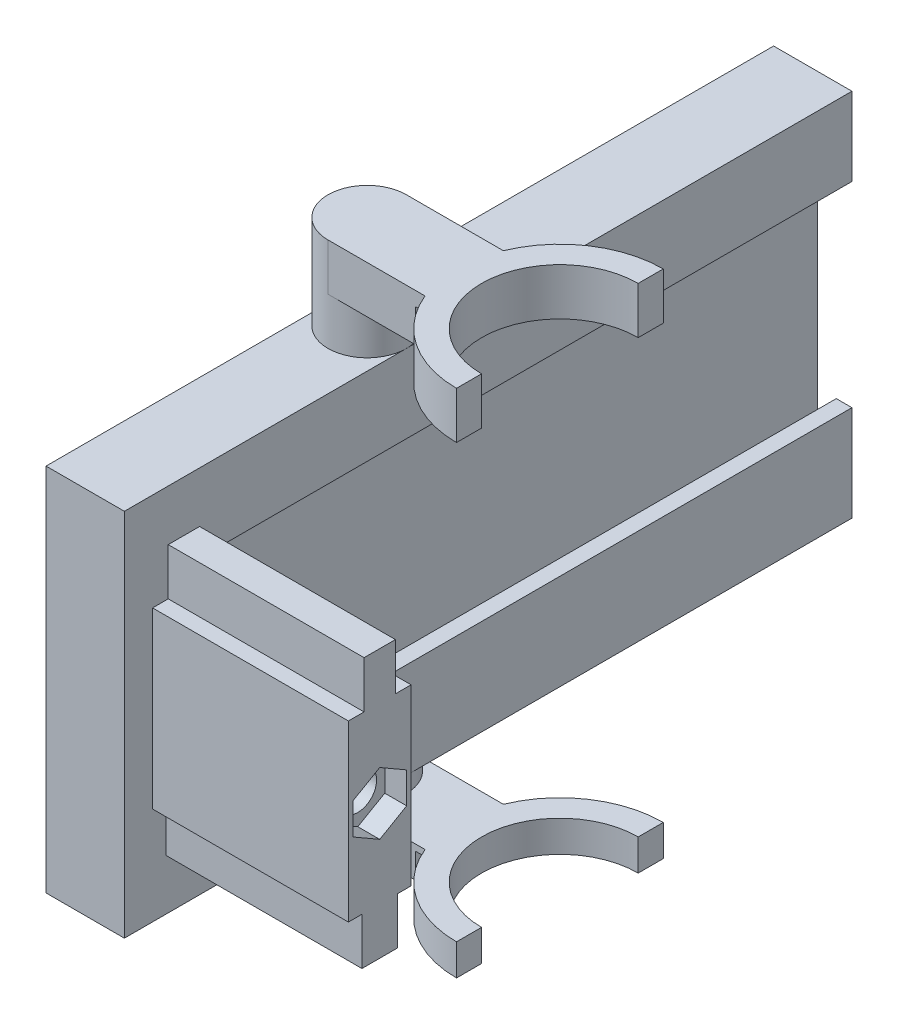
from build123d import *

# Parameters (mm, degrees)
BOSS_EXTRUDE1_DEPTH      = 320
SKETCH2_W                = 25
SKETCH2_H                = 100
BOSS_EXTRUDE2_DEPTH      = 50
CUT_EXTRUDE1_DEPTH       = 337.19190948
CUT_EXTRUDE1_DEPTH_BACK  = 337.19190948
SKETCH3_R                = 5
SKETCH4_W                = 150
SKETCH4_H                = 19.211352241
BOSS_EXTRUDE3_DEPTH      = 100
BOSS_EXTRUDE4_DEPTH      = 100
SKETCH6_W                = 42.1
SKETCH6_H                = 42.1
CUT_EXTRUDE2_DEPTH       = 10
SKETCH7_R                = 11
CUT_EXTRUDE3_DEPTH       = 2
CUT_EXTRUDE4_DEPTH       = 391.24267
CUT_EXTRUDE4_DEPTH_BACK  = 391.24267
SKETCH8_R                = 11
SKETCH10_R               = 25
SKETCH10_R_2             = 11
BOSS_EXTRUDE5_DEPTH      = 18
CUT_EXTRUDE6_DEPTH       = 381.347658714
CUT_EXTRUDE6_DEPTH_BACK  = 381.347658714
BOSS_EXTRUDE6_REACH      = 243.332
SKETCH12_W               = 150
SKETCH12_H               = 15
SKETCH13_W               = 165
SKETCH13_H               = 5
BOSS_EXTRUDE7_DEPTH      = 100
CUT_EXTRUDE7_DEPTH       = 282.821411126
CUT_EXTRUDE7_DEPTH_BACK  = 282.821411126
SKETCH16_W               = 62.5
SKETCH16_H               = 22.206056974
CUT_EXTRUDE9_DEPTH       = 298.574684732
SKETCH17_W               = 62.5
SKETCH17_H               = 5
BOSS_EXTRUDE8_DEPTH      = 15
SKETCH18_W               = 62.5
SKETCH18_H               = 11.362446971
BOSS_EXTRUDE9_DEPTH      = 15
SKETCH19_W               = 25
SKETCH19_H               = 100
BOSS_EXTRUDE11_DEPTH     = 9
SKETCH20_R               = 5
CUT_EXTRUDE10_DEPTH      = 62.5
SKETCH21_R               = 6
CUT_EXTRUDE11_DEPTH      = 62.5
CUT_EXTRUDE12_DEPTH      = 7
CUT_EXTRUDE13_DEPTH      = 261.438787644
CUT_EXTRUDE13_DEPTH_BACK = 261.438787644
SKETCH23_W               = 50
SKETCH23_H               = 100
SKETCH24_W               = 0.5
SKETCH24_H               = 6.741974104
CUT_EXTRUDE16_DEPTH      = 203.211352241
SKETCH26_W               = 0.5
SKETCH26_H               = 6.741974105
CUT_EXTRUDE17_DEPTH      = 203.211352241
SKETCH27_W               = 5
SKETCH27_H               = 0.5
SKETCH27_W_2             = 6
CUT_EXTRUDE18_DEPTH      = 203.211352241
SKETCH29_W               = 25
SKETCH29_H               = 5
BOSS_EXTRUDE13_DEPTH     = 232.211352241
SKETCH31_W               = 5
SKETCH31_H               = 2.5
BOSS_EXTRUDE14_DEPTH     = 203.211352241
SKETCH32_W               = 5
SKETCH32_H               = 0.55
CUT_EXTRUDE20_DEPTH      = 203.211352241
CUT_EXTRUDE21_DEPTH      = 10
SKETCH33_W               = 25
SKETCH33_H               = 4
BOSS_EXTRUDE15_DEPTH     = 232.211352241
SKETCH35_R               = 12.5
BOSS_EXTRUDE16_DEPTH     = 15
SKETCH36_R               = 12.5
BOSS_EXTRUDE17_DEPTH     = 15
SKETCH37_W               = 3
SKETCH37_H               = 3
CUT_EXTRUDE22_DEPTH      = 201.130669564
BOSS_EXTRUDE19_START     = 15
BOSS_EXTRUDE19_DEPTH     = 15
SKETCH39_R               = 12.5
BOSS_EXTRUDE20_DEPTH     = 10
CUT_EXTRUDE23_DEPTH      = 201.130669564
CUT_EXTRUDE23_DEPTH_BACK = 201.130669564
SKETCH40_W               = 3
SKETCH40_H               = 3


with BuildPart() as part:
    # Sketch1 → Boss-Extrude1 (new body)
    with BuildSketch(Plane.XY):
        Polygon((0, 100), (0, 85.5), (-5.5, 85.5), (-5.5, 92.241974104), (-11, 92.241974104), (-11, 13.345911947), (-5.5, 13.345911947), (-5.5, 20.087886052), (0, 20.087886052), (0, 5.587886052), (0, 0), (-25, 0), (-25, 100), align=None)
    extrude(amount=BOSS_EXTRUDE1_DEPTH)

    # Sketch2 → Boss-Extrude2 (add)
    with BuildSketch(Plane(origin=(0, 0, 0), x_dir=(-1, 0, 0), z_dir=(0, 0, -1))):
        with Locations((12.5, 50)):
            Rectangle(SKETCH2_W, SKETCH2_H)
    extrude(amount=BOSS_EXTRUDE2_DEPTH)

    # Sketch3 → Cut-Extrude1 (cut, two sides: drawn at the far end of the back side and taken through both)
    with BuildSketch(Plane(origin=(0, 0, 0), x_dir=(0, 0, -1), z_dir=(1, 0, 0)).offset(-CUT_EXTRUDE1_DEPTH_BACK)):
        with Locations(Location((25, 52.793943026, 0), (0, 0, 90))):
            Circle(SKETCH3_R)
    extrude(amount=CUT_EXTRUDE1_DEPTH + CUT_EXTRUDE1_DEPTH_BACK, mode=Mode.SUBTRACT)

    # Sketch4 → Boss-Extrude3 (add)
    with BuildSketch(Plane(origin=(0, 100, 0), x_dir=(1, 0, 0), z_dir=(0, 1, 0))):
        with Locations((50, -329.60567612)):
            Rectangle(SKETCH4_W, SKETCH4_H)
    extrude(amount=-BOSS_EXTRUDE3_DEPTH)

    # Sketch5 → Boss-Extrude4 (add)
    with BuildSketch(Plane(origin=(0, 0, 0), x_dir=(1, 0, 0), z_dir=(0, 1, 0))):
        Polygon((125, -209.211352241), (125, -339.211352241), (127.245354701, -339.211352241), (140, -339.211352241), (140, -209.211352241), align=None)
    extrude(amount=BOSS_EXTRUDE4_DEPTH)

    # Sketch6 → Cut-Extrude2 (cut)
    with BuildSketch(Plane.ZY.offset(25)):
        with Locations((-25, 52.793943026)):
            Rectangle(SKETCH6_W, SKETCH6_H)
    extrude(amount=-CUT_EXTRUDE2_DEPTH, mode=Mode.SUBTRACT)

    # Sketch7 → Cut-Extrude3 (cut)
    with BuildSketch(Plane.ZY.offset(15)):
        with Locations(Location((-25, 52.793943026, 0), (0, 0, 270))):
            Circle(SKETCH7_R)
    extrude(amount=-CUT_EXTRUDE3_DEPTH, mode=Mode.SUBTRACT)

    # Sketch8 → Cut-Extrude4 (cut, two sides: drawn at the far end of the back side and taken through both)
    with BuildSketch(Plane.ZY.offset(25).offset(-CUT_EXTRUDE4_DEPTH_BACK)):
        with Locations(Location((-25, 52.793943026, 0), (0, 0, 270))):
            Circle(SKETCH8_R)
    extrude(amount=CUT_EXTRUDE4_DEPTH + CUT_EXTRUDE4_DEPTH_BACK, mode=Mode.SUBTRACT)

    # Sketch10 → Boss-Extrude5 (add)
    with BuildSketch(Plane(origin=(0, 0, 0), x_dir=(0, 0, -1), z_dir=(1, 0, 0))):
        with Locations((25, 52.793943026)):
            Circle(SKETCH10_R)
        with Locations(Location((25, 52.793943026, 0), (0, 0, 270))):
            Circle(SKETCH10_R_2, mode=Mode.SUBTRACT)
    extrude(amount=BOSS_EXTRUDE5_DEPTH)

    # Sketch11 → Cut-Extrude6 (cut, two sides: drawn at the far end of the back side and taken through both)
    with BuildSketch(Plane(origin=(0, 0, 0), x_dir=(1, 0, 0), z_dir=(0, 1, 0)).offset(-CUT_EXTRUDE6_DEPTH_BACK)):
        Polygon((-25, -339.211352241), (-25, -218.211352241), (83.728432641, -218.211352241), (83.728432641, -190.050980202), (162.673418017, -190.050980202), (162.673418017, -339.211352241), align=None)
    extrude(amount=CUT_EXTRUDE6_DEPTH + CUT_EXTRUDE6_DEPTH_BACK, mode=Mode.SUBTRACT)

    # Boss-Extrude6: up to this face of the body (flat: up to its plane)
    boss_extrude6_end = Plane(part.part.faces().sort_by_distance((-12.5, 100, 84.10567612))[0])
    # Sketch12 → Boss-Extrude6 (add, up to the picked face)
    with BuildSketch(Plane(origin=(0, 0, 0), x_dir=(1, 0, 0), z_dir=(0, 1, 0)), mode=Mode.PRIVATE) as boss_extrude6_sk1:
        with Locations((50, -210.711352241)):
            Rectangle(SKETCH12_W, SKETCH12_H)
    boss_extrude6_tool1 = split(extrude(boss_extrude6_sk1.sketch, amount=BOSS_EXTRUDE6_REACH, mode=Mode.PRIVATE), bisect_by=boss_extrude6_end, keep=Keep.BOTH, mode=Mode.PRIVATE)
    # Sketch12 → Boss-Extrude6 (add, up to the picked face)
    with BuildSketch(Plane(origin=(0, 0, 0), x_dir=(1, 0, 0), z_dir=(0, 1, 0)), mode=Mode.PRIVATE) as boss_extrude6_sk2:
        Polygon((140, -118.211352241), (125, -118.211352241), (125, -203.211352241), (125, -218.211352241), (140, -218.211352241), align=None)
    boss_extrude6_tool2 = split(extrude(boss_extrude6_sk2.sketch, amount=BOSS_EXTRUDE6_REACH, mode=Mode.PRIVATE), bisect_by=boss_extrude6_end, keep=Keep.BOTH, mode=Mode.PRIVATE)
    add(boss_extrude6_tool1.solids().sort_by(Axis((50, 0, 210.711352), (0, 1, 0)))[0])
    add(boss_extrude6_tool2.solids().sort_by(Axis((132.5, 0, 168.211352), (0, 1, 0)))[0])

    # Sketch13 → Boss-Extrude7 (add)
    with BuildSketch(Plane(origin=(0, 0, 0), x_dir=(1, 0, 0), z_dir=(0, 1, 0))):
        with Locations((57.5, -220.711352241)):
            Rectangle(SKETCH13_W, SKETCH13_H)
    extrude(amount=BOSS_EXTRUDE7_DEPTH)

    # Sketch14 → Cut-Extrude7 (cut, two sides: drawn at the far end of the back side and taken through both)
    with BuildSketch(Plane(origin=(0, 0, 0), x_dir=(1, 0, 0), z_dir=(0, 1, 0)).offset(-CUT_EXTRUDE7_DEPTH_BACK)):
        Polygon((62.5, -203.211352241), (62.5, -244.24795379), (164.214361429, -244.24795379), (164.214361429, -100.335073146), (62.5, -100.335073146), align=None)
    extrude(amount=CUT_EXTRUDE7_DEPTH + CUT_EXTRUDE7_DEPTH_BACK, mode=Mode.SUBTRACT)

    # Sketch16 → Cut-Extrude9 (cut, through all)
    with BuildSketch(Plane.XY.offset(223.211352241)):
        with Locations((31.25, 88.896971513)):
            Rectangle(SKETCH16_W, SKETCH16_H)
        with Locations((31.25, 11.103028487)):
            Rectangle(SKETCH16_W, SKETCH16_H)
    extrude(amount=-CUT_EXTRUDE9_DEPTH, mode=Mode.SUBTRACT)

    # Sketch17 → Boss-Extrude8 (add)
    with BuildSketch(Plane(origin=(0, 77.793943026, 0), x_dir=(1, 0, 0), z_dir=(0, 1, 0))):
        with Locations((31.25, -210.711352241)):
            Rectangle(SKETCH17_W, SKETCH17_H)
        with Locations((31.25, -215.711352241)):
            Rectangle(SKETCH17_W, SKETCH17_H)
    extrude(amount=BOSS_EXTRUDE8_DEPTH)

    # Sketch18 → Boss-Extrude9 (add)
    with BuildSketch(Plane.XZ.offset(-22.206056974)):
        with Locations((31.25, 213.211352241)):
            Rectangle(SKETCH18_W, SKETCH18_H)
    extrude(amount=BOSS_EXTRUDE9_DEPTH)

    # Sketch19 → Boss-Extrude11 (add)
    with BuildSketch(Plane.XY.offset(223.211352241)):
        with Locations((-12.5, 50)):
            Rectangle(SKETCH19_W, SKETCH19_H)
    extrude(amount=BOSS_EXTRUDE11_DEPTH)

    # Sketch20 → Cut-Extrude10 (cut)
    with BuildSketch(Plane(origin=(62.5, 0, 0), x_dir=(0, 0, -1), z_dir=(1, 0, 0))):
        with Locations((-213.211352241, 50)):
            Circle(SKETCH20_R)
    extrude(amount=-CUT_EXTRUDE10_DEPTH, mode=Mode.SUBTRACT)

    # Sketch21 → Cut-Extrude11 (cut)
    with BuildSketch(Plane(origin=(62.5, 0, 0), x_dir=(0, 0, -1), z_dir=(1, 0, 0))):
        with Locations((-213.211352241, 50)):
            Circle(SKETCH21_R)
    extrude(amount=-CUT_EXTRUDE11_DEPTH, mode=Mode.SUBTRACT)

    # Sketch22 → Cut-Extrude12 (cut)
    with BuildSketch(Plane(origin=(62.5, 0, 0), x_dir=(0, 0, -1), z_dir=(1, 0, 0))):
        Polygon((-204.611352241, 45.034787685), (-204.611352241, 54.965212315), (-213.211352241, 59.93042463), (-221.811352241, 54.965212315), (-221.811352241, 45.034787685), (-213.211352241, 40.06957537), align=None)
    extrude(amount=-CUT_EXTRUDE12_DEPTH, mode=Mode.SUBTRACT)

    # Sketch23 → Cut-Extrude13 (cut, two sides: drawn at the far end of the back side and taken through both)
    with BuildSketch(Plane(origin=(0, 0, 0), x_dir=(0, 0, -1), z_dir=(1, 0, 0)).offset(-CUT_EXTRUDE13_DEPTH_BACK)):
        with Locations((25, 50)):
            Rectangle(SKETCH23_W, SKETCH23_H)
    extrude(amount=CUT_EXTRUDE13_DEPTH + CUT_EXTRUDE13_DEPTH_BACK, mode=Mode.SUBTRACT)

    # Sketch24 → Cut-Extrude16 (cut)
    with BuildSketch(Plane(origin=(0, 0, 0), x_dir=(-1, 0, 0), z_dir=(0, 0, -1))):
        with Locations((5.25, 88.870987052)):
            Rectangle(SKETCH24_W, SKETCH24_H)
    extrude(amount=-CUT_EXTRUDE16_DEPTH, mode=Mode.SUBTRACT)

    # Sketch26 → Cut-Extrude17 (cut)
    with BuildSketch(Plane(origin=(0, 0, 0), x_dir=(-1, 0, 0), z_dir=(0, 0, -1))):
        with Locations((5.25, 16.716899)):
            Rectangle(SKETCH26_W, SKETCH26_H)
    extrude(amount=-CUT_EXTRUDE17_DEPTH, mode=Mode.SUBTRACT)

    # Sketch27 → Cut-Extrude18 (cut)
    with BuildSketch(Plane(origin=(0, 0, 0), x_dir=(-1, 0, 0), z_dir=(0, 0, -1))):
        with Locations((2.5, 85.75)):
            Rectangle(SKETCH27_W, SKETCH27_H)
        with Locations((8, 92.491974104)):
            Rectangle(SKETCH27_W_2, SKETCH27_H)
        with Locations((8, 13.095911947)):
            Rectangle(SKETCH27_W_2, SKETCH27_H)
        with Locations((2.5, 19.837886052)):
            Rectangle(SKETCH27_W, SKETCH27_H)
    extrude(amount=-CUT_EXTRUDE18_DEPTH, mode=Mode.SUBTRACT)

    # Sketch29 → Boss-Extrude13 (add)
    with BuildSketch(Plane(origin=(0, 0, 0), x_dir=(-1, 0, 0), z_dir=(0, 0, -1))):
        with Locations((12.5, 102.5)):
            Rectangle(SKETCH29_W, SKETCH29_H)
        with Locations((12.5, -2.5)):
            Rectangle(SKETCH29_W, SKETCH29_H)
    extrude(amount=-BOSS_EXTRUDE13_DEPTH)

    # Sketch31 → Boss-Extrude14 (add)
    with BuildSketch(Plane(origin=(0, 0, 0), x_dir=(-1, 0, 0), z_dir=(0, 0, -1))):
        with Locations((2.5, 84.75)):
            Rectangle(SKETCH31_W, SKETCH31_H)
        with Locations((2.5, 20.837886052)):
            Rectangle(SKETCH31_W, SKETCH31_H)
    extrude(amount=-BOSS_EXTRUDE14_DEPTH)

    # Sketch32 → Cut-Extrude20 (cut)
    with BuildSketch(Plane(origin=(0, 0, 0), x_dir=(-1, 0, 0), z_dir=(0, 0, -1))):
        with Locations((2.5, 21.812886052)):
            Rectangle(SKETCH32_W, SKETCH32_H)
        with Locations((2.5, 83.775)):
            Rectangle(SKETCH32_W, SKETCH32_H)
    extrude(amount=-CUT_EXTRUDE20_DEPTH, mode=Mode.SUBTRACT)

    # Sketch30 → Cut-Extrude21 (cut)
    with BuildSketch(Plane(origin=(0, 0, 0), x_dir=(-1, 0, 0), z_dir=(0, 0, -1))):
        Polygon((17.465212315, 103.6), (7.534787685, 103.6), (2.56957537, 95), (7.534787685, 86.4), (17.465212315, 86.4), (22.43042463, 95), align=None)
        Polygon((17.465212315, 13.6), (7.534787685, 13.6), (2.56957537, 5), (7.534787685, -3.6), (17.465212315, -3.6), (22.43042463, 5), align=None)
    extrude(amount=-CUT_EXTRUDE21_DEPTH, mode=Mode.SUBTRACT)

    # Sketch33 → Boss-Extrude15 (add)
    with BuildSketch(Plane(origin=(0, 0, 0), x_dir=(-1, 0, 0), z_dir=(0, 0, -1))):
        with Locations((12.5, 107)):
            Rectangle(SKETCH33_W, SKETCH33_H)
        with Locations((12.5, -7)):
            Rectangle(SKETCH33_W, SKETCH33_H)
    extrude(amount=-BOSS_EXTRUDE15_DEPTH)

    # Sketch35 → Boss-Extrude16 (add)
    with BuildSketch(Plane(origin=(0, 109, 0), x_dir=(1, 0, 0), z_dir=(0, 1, 0))):
        with Locations(Location((-12.5, -142.211352241, 0), (0, 0, 180))):
            Circle(SKETCH35_R)
    extrude(amount=BOSS_EXTRUDE16_DEPTH)

    # Sketch36 → Boss-Extrude17 (add)
    with BuildSketch(Plane(origin=(0, 124, 0), x_dir=(1, 0, 0), z_dir=(0, 1, 0))):
        with BuildLine():
            Line((49, -117.211352241), (49, -109.211352241))
            ThreePointArc((49, -109.211352241), (16, -142.211352241), (49, -175.211352241))
            Line((49, -175.211352241), (49, -167.211352241))
            ThreePointArc((49, -167.211352241), (24, -142.211352241), (49, -117.211352241))
        make_face()
        with BuildLine():
            ThreePointArc((18.459043892, -154.711352241), (16, -142.211352241), (18.459043892, -129.711352241))
            Line((18.459043892, -129.711352241), (-12.5, -129.711352241))
            ThreePointArc((-12.5, -129.711352241), (-3.661165235, -133.372517476), (0, -142.211352241))
            ThreePointArc((0, -142.211352241), (-3.661165235, -151.050187006), (-12.5, -154.711352241))
            Line((-12.5, -154.711352241), (18.459043892, -154.711352241))
        make_face()
        with Locations(Location((-12.5, -142.211352241, 0), (0, 0, 90))):
            Circle(SKETCH36_R)
    extrude(amount=BOSS_EXTRUDE17_DEPTH)

    # Sketch37 → Cut-Extrude22 (cut, through all)
    with BuildSketch(Plane(origin=(0, 0, 129.711352241), x_dir=(-1, 0, 0), z_dir=(0, 0, -1))):
        with Locations((-16.959043892, 133)):
            Rectangle(SKETCH37_W, SKETCH37_H)
        with Locations((-16.959043892, 130)):
            Rectangle(SKETCH37_W, SKETCH37_H)
    extrude(amount=-CUT_EXTRUDE22_DEPTH, mode=Mode.SUBTRACT)

    # Sketch38 → Boss-Extrude19 (add)
    with BuildSketch(Plane.XZ.offset(9).offset(BOSS_EXTRUDE19_START)):
        with BuildLine():
            ThreePointArc((0, 142.211352241), (-12.5, 154.711352241), (-25, 142.211352241))
            Line((-25, 142.211352241), (0, 142.211352241))
        make_face()
        with BuildLine():
            Line((0, 142.211352241), (-25, 142.211352241))
            ThreePointArc((-25, 142.211352241), (-12.5, 129.711352241), (0, 142.211352241))
        make_face()
    extrude(amount=-BOSS_EXTRUDE19_DEPTH)

    # Sketch39 → Boss-Extrude20 (add)
    with BuildSketch(Plane.XZ.offset(24)):
        with Locations(Location((-12.5, 142.211352241, 0), (0, 0, 270))):
            Circle(SKETCH39_R)
        with BuildLine():
            ThreePointArc((18.459043892, 129.711352241), (16, 142.211352241), (18.459043892, 154.711352241))
            Line((18.459043892, 154.711352241), (-12.5, 154.711352241))
            ThreePointArc((-12.5, 154.711352241), (-3.661165235, 151.050187006), (0, 142.211352241))
            ThreePointArc((0, 142.211352241), (-3.661165235, 133.372517476), (-12.5, 129.711352241))
            Line((-12.5, 129.711352241), (18.459043892, 129.711352241))
        make_face()
        with BuildLine():
            ThreePointArc((49, 167.211352241), (24, 142.211352241), (49, 117.211352241))
            Line((49, 117.211352241), (49, 109.211352241))
            ThreePointArc((49, 109.211352241), (16, 142.211352241), (49, 175.211352241))
            Line((49, 175.211352241), (49, 167.211352241))
        make_face()
    extrude(amount=-BOSS_EXTRUDE20_DEPTH)

    # Sketch40 → Cut-Extrude23 (cut, two sides: drawn at the far end of the back side and taken through both)
    with BuildSketch(Plane(origin=(0, 0, 129.711352241), x_dir=(-1, 0, 0), z_dir=(0, 0, -1)).offset(-CUT_EXTRUDE23_DEPTH_BACK)):
        with Locations((-16.959043892, -17.5)):
            Rectangle(SKETCH40_W, SKETCH40_H)
        with Locations((-16.959043892, -20.5)):
            Rectangle(SKETCH40_W, SKETCH40_H)
    extrude(amount=CUT_EXTRUDE23_DEPTH + CUT_EXTRUDE23_DEPTH_BACK, mode=Mode.SUBTRACT)


solid = part.part
